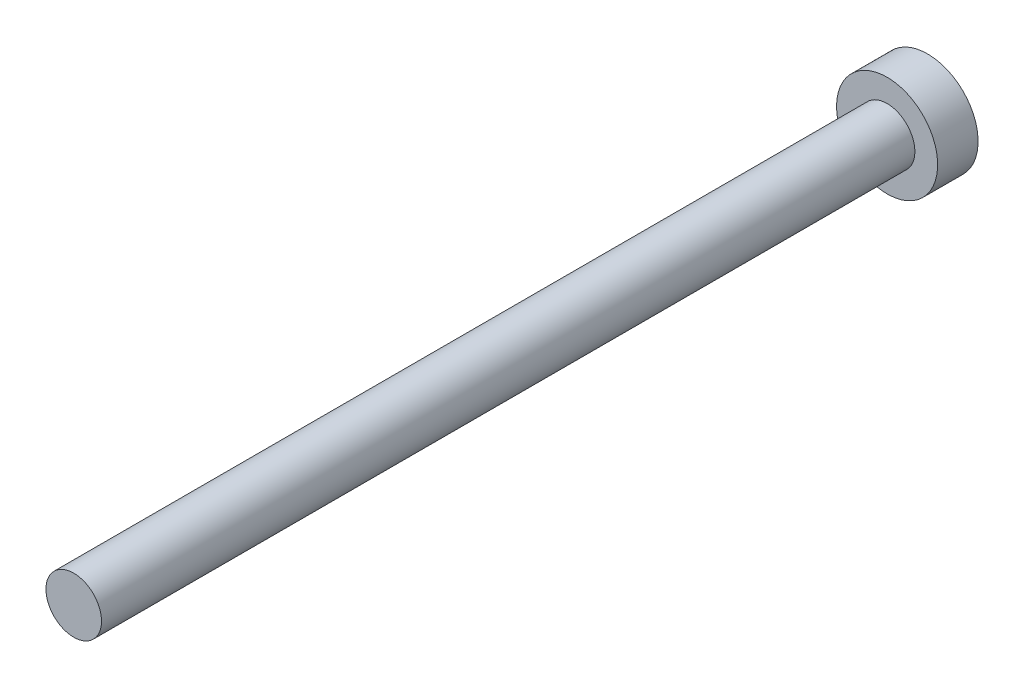
from build123d import *

# Parameters (mm, degrees)
SKETCH1_R                           = 1.5
BOSS_EXTRUDE1_DEPTH                 = 42
SKETCH2_R                           = 2.75
BOSS_EXTRUDE2_DEPTH                 = 2.2
ESCALA1_SCALE                       = 1.5
ESCALA2_SCALE                       = 1.5
CROQUIS1_R                          = 3.4
SALIENTE_EXTRUIR1_DEPTH             = 10
SALIENTE_EXTRUIR1_DIRECTION_2_REACH = 96.904


with BuildPart() as part:
    # Sketch1 → Boss-Extrude1 (new body)
    with BuildSketch(Plane.XY):
        with Locations(Location((0, 0, 0), (0, 0, 180))):
            Circle(SKETCH1_R)
    extrude(amount=BOSS_EXTRUDE1_DEPTH)

    # Sketch2 → Boss-Extrude2 (add)
    with BuildSketch(Plane(origin=(0, 0, 0), x_dir=(-1, 0, 0), z_dir=(0, 0, -1))):
        Circle(SKETCH2_R)
    extrude(amount=-BOSS_EXTRUDE2_DEPTH)


with BuildPart() as part_1:
    # Escala1: scaled about (0, 0, 0)
    add(part.part.scale(ESCALA1_SCALE))


with BuildPart() as part_2:
    # Escala2: scaled about (0, 0, 0)
    add(part_1.part.scale(ESCALA2_SCALE))

    # Croquis1 → Saliente-Extruir1 (add)
    with BuildSketch(Plane.XY.offset(94.5)):
        Circle(CROQUIS1_R)
    extrude(amount=SALIENTE_EXTRUIR1_DEPTH)

    # Croquis1 → Saliente-Extruir1 direction 2 (add, up to next)
    with BuildSketch(Plane.XY.offset(94.5), mode=Mode.PRIVATE) as saliente_extruir1_direction_2_sk1:
        Circle(CROQUIS1_R)
    saliente_extruir1_direction_2_tool1 = extrude(saliente_extruir1_direction_2_sk1.sketch, amount=-SALIENTE_EXTRUIR1_DIRECTION_2_REACH, mode=Mode.PRIVATE) - part_2.part
    add(saliente_extruir1_direction_2_tool1.solids().sort_by_distance((0, 0, 94.5))[0])


solid = part_2.part
